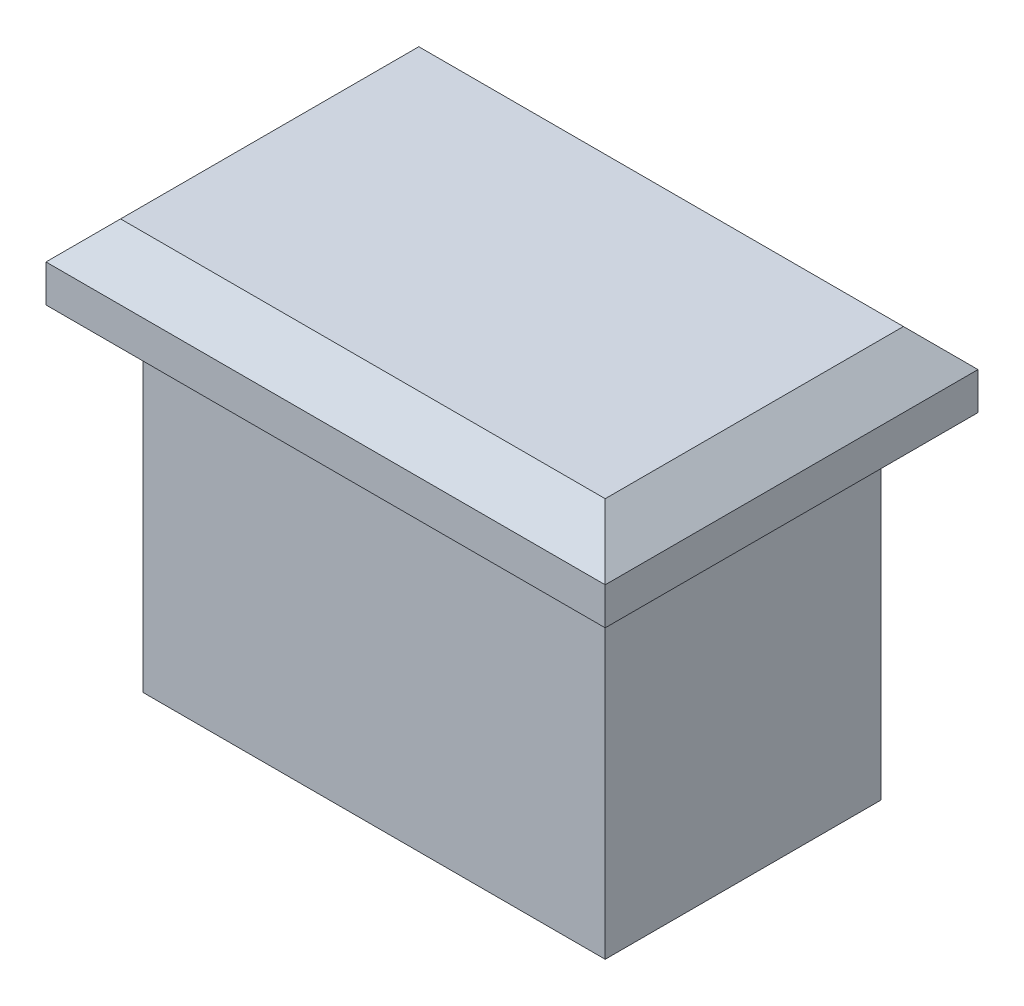
from build123d import *

# Parameters (mm, degrees)
SKETCH_1_W      = 15
SKETCH_1_H      = 10
SKETCH_1_W_2    = 12.4
SKETCH_1_H_2    = 7.4
EXTRUDE_1_DEPTH = 2
SKETCH_2_W      = 12.4
SKETCH_2_H      = 7.4
EXTRUDE_2_DEPTH = 10
CHAMFER_1_SIZE  = 1
CHAMFER_2_SIZE  = 1


with BuildPart() as part:
    # ｽｹｯﾁ1 → ﾎﾞｽ - 押し出し1 (new body)
    # profile 1 of 2: a face of its own
    with BuildSketch(Plane(origin=(0, 0, 0), x_dir=(1, 0, 0), z_dir=(0, 1, 0))):
        Rectangle(SKETCH_1_W, SKETCH_1_H)
        Rectangle(SKETCH_1_W_2, SKETCH_1_H_2, mode=Mode.SUBTRACT)
    # profile 2 of 2: a face of its own
    with BuildSketch(Plane(origin=(0, 0, 0), x_dir=(1, 0, 0), z_dir=(0, 1, 0))):
        Rectangle(SKETCH_1_W_2, SKETCH_1_H_2)
    extrude(amount=EXTRUDE_1_DEPTH)

    # ｽｹｯﾁ2 → ﾎﾞｽ - 押し出し2 (add)
    with BuildSketch(Plane.XZ):
        Rectangle(SKETCH_2_W, SKETCH_2_H)
    extrude(amount=EXTRUDE_2_DEPTH)

    # 面取り1
    chamfer_1_edges = [part.edges().sort_by_distance(p)[0] for p in [
        (0, -10, 3.7),
        (-6.2, -10, 0),
        (0, -10, -3.7),
        (6.2, -10, 0),
    ]]
    chamfer(chamfer_1_edges, length=CHAMFER_1_SIZE)

    # 面取り2
    chamfer_2_edges = [part.edges().sort_by_distance(p)[0] for p in [
        (0, 2, -5),
        (-7.5, 2, 0),
        (0, 2, 5),
        (7.5, 2, 0),
    ]]
    chamfer(chamfer_2_edges, length=CHAMFER_2_SIZE)


solid = part.part
